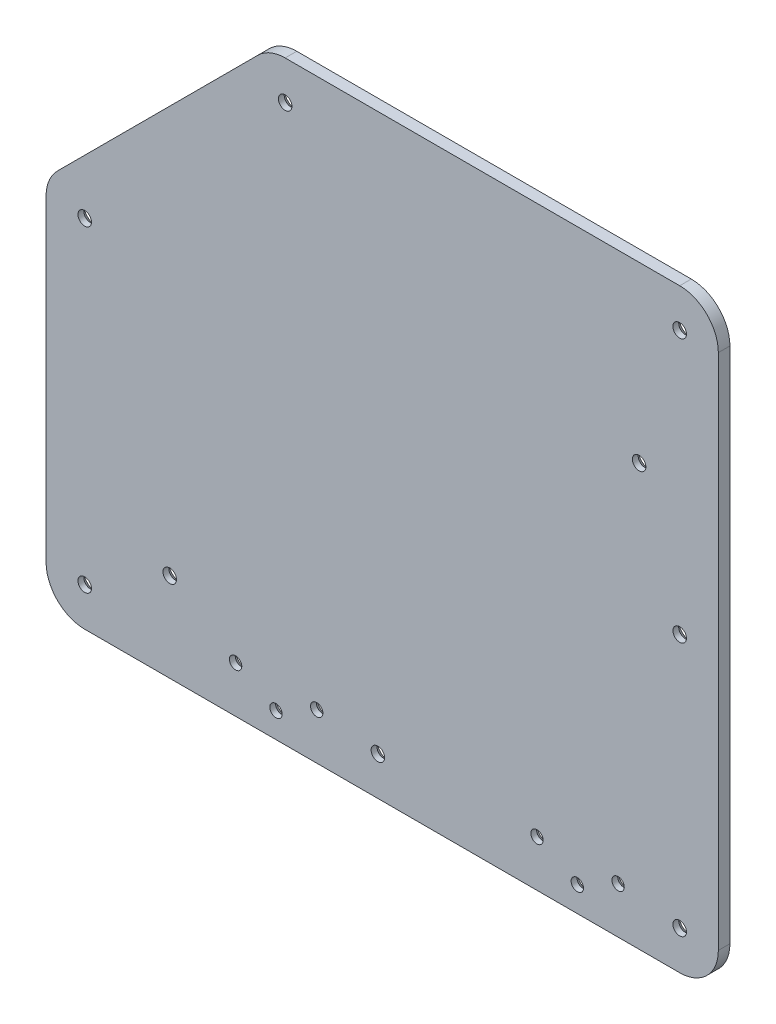
from build123d import *

# Parameters (mm, degrees)
ESTRUSIONE_ESTRUSIONE1_DEPTH = 3
RACCORDO1_R                  = 10
SCHIZZO2_R                   = 1.75
TAGLIO_ESTRUSIONE1_DEPTH     = 3
SCHIZZO3_R                   = 1.75
TAGLIO_ESTRUSIONE2_DEPTH     = 10
SCHIZZO6_R                   = 1.6
TAGLIO_ESTRUSIONE4_DEPTH     = 10
SMUSSO1_SIZE                 = 1.5


with BuildPart() as part:
    # Schizzo1 → Estrusione-Estrusione1 (new body)
    with BuildSketch(Plane.XY):
        Polygon((172, 152), (55.74011537, 152), (-2, 94.25988463), (-2, -2), (172, -2), align=None)
    extrude(amount=ESTRUSIONE_ESTRUSIONE1_DEPTH)

    # Raccordo1
    raccordo1_edges = [part.edges().sort_by_distance(p)[0] for p in [
        (172, -2, 1.5),
        (-2, -2, 1.5),
        (-2, 94.25988463, 1.5),
        (55.74011537, 152, 1.5),
        (172, 152, 1.5),
    ]]
    fillet(raccordo1_edges, radius=RACCORDO1_R)

    # Schizzo2 → Taglio-Estrusione1 (cut)
    with BuildSketch(Plane.XY.offset(3)):
        with Locations((162, 142)):
            Circle(SCHIZZO2_R)
        with Locations((59.882250994, 142)):
            Circle(SCHIZZO2_R)
        with Locations((8, 90.117749006)):
            Circle(SCHIZZO2_R)
        with Locations((8, 8)):
            Circle(SCHIZZO2_R)
        with Locations((162, 8)):
            Circle(SCHIZZO2_R)
        with Locations((162, 73.82941029)):
            Circle(SCHIZZO2_R)
        with Locations((83.881838923, 8)):
            Circle(SCHIZZO2_R)
    extrude(amount=-TAGLIO_ESTRUSIONE1_DEPTH, mode=Mode.SUBTRACT)

    # Schizzo3 → Taglio-Estrusione2 (cut)
    with BuildSketch(Plane.XY.offset(3)):
        with Locations((151.5, 107)):
            Circle(SCHIZZO3_R)
        with Locations((30, 21)):
            Circle(SCHIZZO3_R)
    extrude(amount=-TAGLIO_ESTRUSIONE2_DEPTH, mode=Mode.SUBTRACT)

    # Schizzo6 → Taglio-Estrusione4 (cut)
    with BuildSketch(Plane.XY.offset(3)):
        with Locations((57.5, 4.5)):
            Circle(SCHIZZO6_R)
        with Locations((68.053639934, 10)):
            Circle(SCHIZZO6_R)
        with Locations((47.053639934, 10)):
            Circle(SCHIZZO6_R)
        with Locations((125.053639934, 10)):
            Circle(SCHIZZO6_R)
        with Locations((146.053639934, 10)):
            Circle(SCHIZZO6_R)
        with Locations((135.5, 4.5)):
            Circle(SCHIZZO6_R)
    extrude(amount=-TAGLIO_ESTRUSIONE4_DEPTH, mode=Mode.SUBTRACT)

    # Smusso1
    smusso1_edges = [part.edges().sort_by_distance(p)[0] for p in [
        (45.453639934, 10, 0),
        (66.453639934, 10, 0),
        (144.453639934, 10, 0),
        (55.9, 4.5, 0),
        (123.453639934, 10, 0),
        (133.9, 4.5, 0),
        (58.132250994, 142, 0),
        (6.25, 90.117749006, 0),
        (6.25, 8, 0),
        (160.25, 8, 0),
        (160.25, 73.82941029, 0),
        (82.131838923, 8, 0),
        (160.25, 142, 0),
        (149.75, 107, 0),
        (28.25, 21, 0),
    ]]
    chamfer(smusso1_edges, length=SMUSSO1_SIZE)


solid = part.part
